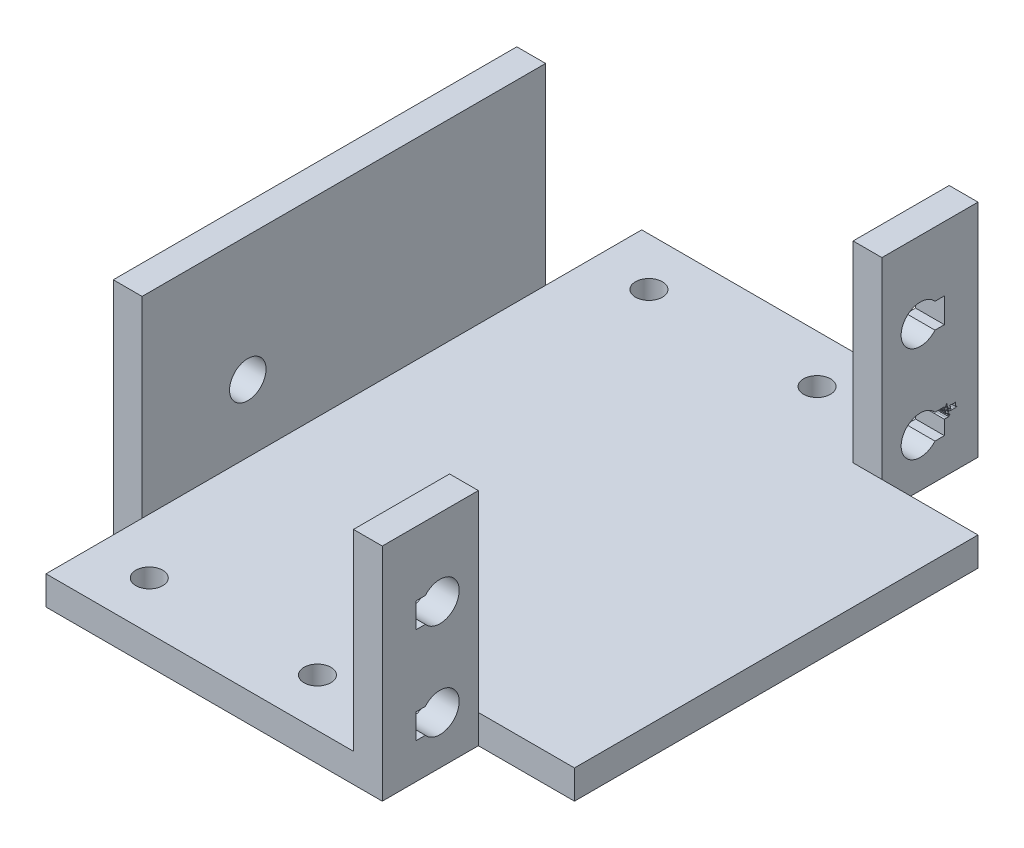
from build123d import *

# Parameters (mm, degrees)
SKETCH_2_R          = 1.4
EXTRUDE_1_DEPTH     = 3
SKETCH_3_W          = 3
SKETCH_3_H          = 10
SKETCH_3_H_2        = 42
EXTRUDE_2_DEPTH     = 23
SKETCH_4_R          = 1.9
CUT_EXTRUDE_1_DEPTH = 3
CUT_EXTRUDE_2_DEPTH = 3


with BuildPart() as part:
    # 草图2 → 凸台-拉伸1 (new body)
    with BuildSketch(Plane(origin=(0, 0, 0), x_dir=(1, 0, 0), z_dir=(0, 1, 0))):
        Polygon((14, 21), (11, 21), (11, 31), (-21, 31), (-21, 21), (-21, -21), (-21, -31), (11, -31), (11, -21), (14, -21), (24, -21), (24, 21), align=None)
        with Locations(Location((-15.25, -26, 0), (0, 0, 270))):
            Circle(SKETCH_2_R, mode=Mode.SUBTRACT)
        with Locations(Location((2.25, -26, 0), (0, 0, 270))):
            Circle(SKETCH_2_R, mode=Mode.SUBTRACT)
        with Locations(Location((-15.25, 26, 0), (0, 0, 270))):
            Circle(SKETCH_2_R, mode=Mode.SUBTRACT)
        with Locations(Location((2.25, 26, 0), (0, 0, 270))):
            Circle(SKETCH_2_R, mode=Mode.SUBTRACT)
    extrude(amount=EXTRUDE_1_DEPTH)

    # 草图3 → 凸台-拉伸2 (add)
    with BuildSketch(Plane(origin=(0, 0, 0), x_dir=(1, 0, 0), z_dir=(0, 1, 0))):
        with Locations((12.5, 26)):
            Rectangle(SKETCH_3_W, SKETCH_3_H)
        with Locations((12.5, -26)):
            Rectangle(SKETCH_3_W, SKETCH_3_H)
        with Locations((-22.5, 0)):
            Rectangle(SKETCH_3_W, SKETCH_3_H_2)
    extrude(amount=EXTRUDE_2_DEPTH)

    # 草图4 → 切除-拉伸1 (cut)
    with BuildSketch(Plane.ZY.offset(24)):
        with Locations((10.000200581, 10.000033117)):
            Circle(SKETCH_4_R)
    extrude(amount=-CUT_EXTRUDE_1_DEPTH, mode=Mode.SUBTRACT)

    # 草图5 → 切除-拉伸2 (cut)
    with BuildSketch(Plane(origin=(14, 0, 0), x_dir=(0, 0, -1), z_dir=(1, 0, 0))):
        with BuildLine():
            Line((27.500074714, 16.300093821), (26.519943129, 16.300093821))
            ThreePointArc((26.519943129, 16.300093821), (23.000074714, 15.000093821), (26.519943129, 13.700093821))
            Line((26.519943129, 13.700093821), (27.500074714, 13.700093821))
            Line((27.500074714, 13.700093821), (27.500074714, 16.300093821))
        make_face()
        with BuildLine():
            Line((-26.519793701, 6.300093821), (-27.499925286, 6.300093821))
            Line((-27.499925286, 6.300093821), (-27.499925286, 3.700093821))
            Line((-27.499925286, 3.700093821), (-26.519793701, 3.700093821))
            ThreePointArc((-26.519793701, 3.700093821), (-22.999925286, 5.000093821), (-26.519793701, 6.300093821))
        make_face()
        with BuildLine():
            Line((-27.499925286, 16.300093821), (-27.499925286, 13.700093821))
            Line((-27.499925286, 13.700093821), (-26.519793701, 13.700093821))
            ThreePointArc((-26.519793701, 13.700093821), (-22.999925286, 15.000093821), (-26.519793701, 16.300093821))
            Line((-26.519793701, 16.300093821), (-27.499925286, 16.300093821))
        make_face()
        with BuildLine():
            Line((27.500074714, 6.115914392), (27.552958342, 6.141366405))
            Line((27.552958342, 6.141366405), (27.662909333, 6.190908276))
            Line((27.662909333, 6.190908276), (27.783727573, 6.247162272))
            Line((27.783727573, 6.247162272), (27.746970701, 6.469301628))
            Line((27.746970701, 6.469301628), (27.706058705, 6.469301628))
            add(Edge.make_bspline(
                [(27.706058705, 6.469301628), (27.704396649, 6.45787626), (27.701193778, 6.435858947), (27.694139947, 6.404343156), (27.68548571, 6.375802175), (27.676081998, 6.349713803), (27.664554434, 6.326925453), (27.652002919, 6.306673286), (27.638013907, 6.289163989), (27.615780806, 6.269408305), (27.582913248, 6.245946024), (27.542398973, 6.218404009), (27.513558276, 6.200703221), (27.500074714, 6.192616242)],
                knots=[0.618132606, 0.618132606, 0.618132606, 0.618132606, 0.654491725, 0.688198628, 0.719732119, 0.748405423, 0.775420351, 0.800001443, 0.823377793, 0.845704363, 0.893426251, 0.950483432, 1, 1, 1, 1], degree=3))
            Line((27.500074714, 6.192616242), (27.500074714, 6.300093821))
            Line((27.500074714, 6.300093821), (26.519943129, 6.300093821))
            ThreePointArc((26.519943129, 6.300093821), (23.000074714, 5.000093821), (26.519943129, 3.700093821))
            Line((26.519943129, 3.700093821), (27.500074714, 3.700093821))
            Line((27.500074714, 3.700093821), (27.500074714, 5.181510314))
            Line((27.500074714, 5.181510314), (27.721081078, 5.187605485))
            Line((27.721081078, 5.187605485), (27.753363201, 5.18984286))
            add(Edge.make_bspline(
                [(27.753363201, 5.18984286), (27.759016371, 5.18971796), (27.772708972, 5.18941544), (27.794575853, 5.186428955), (27.816978948, 5.184377517), (27.837005092, 5.182192987), (27.8555767, 5.18031232), (27.873576813, 5.174878748), (27.889338348, 5.170691781), (27.900477042, 5.167910831), (27.90813758, 5.169187885), (27.915838929, 5.171145749), (27.926351211, 5.17493901), (27.934474077, 5.177517939), (27.93906531, 5.178975611)],
                knots=[0, 0, 0, 0, 0.089602961, 0.217028202, 0.349494203, 0.446323144, 0.536639958, 0.644815585, 0.742758213, 0.797475586, 0.823041142, 0.864835072, 0.92360162, 1, 1, 1, 1], degree=3))
            Line((27.93906531, 5.178975611), (27.984452056, 5.194317609))
            Line((27.984452056, 5.194317609), (28.029519178, 5.209339983))
            add(Edge.make_bspline(
                [(28.029519178, 5.209339983), (28.034969154, 5.211217153), (28.04485416, 5.214621909), (28.057949488, 5.219746641), (28.068066927, 5.224032739), (28.074876518, 5.228153118), (28.079097506, 5.231646205), (28.079942949, 5.236121148), (28.075615588, 5.238790895), (28.063020887, 5.242657385), (28.040485407, 5.24724816), (28.02033809, 5.249255838), (28.010341679, 5.25025198)],
                knots=[0, 0, 0, 0, 0.133480499, 0.242102974, 0.326053141, 0.38700961, 0.42718664, 0.449535831, 0.479255152, 0.529229463, 0.766419721, 1, 1, 1, 1], degree=3))
            Line((28.010341679, 5.25025198), (27.882811315, 5.25025198))
            Line((27.882811315, 5.25025198), (27.839661943, 5.470473586))
            Line((27.839661943, 5.470473586), (27.889523439, 5.440109214))
            Line((27.889523439, 5.440109214), (27.982214682, 5.373307594))
            Line((27.982214682, 5.373307594), (28.020889303, 5.345180597))
            Line((28.020889303, 5.345180597), (28.044861176, 5.330158223))
            Line((28.044861176, 5.330158223), (28.077143299, 5.345180597))
            Line((28.077143299, 5.345180597), (28.046778926, 5.375544969))
            add(Edge.make_bspline(
                [(28.046778926, 5.375544969), (28.037373427, 5.384366411), (28.016713165, 5.403743724), (27.981265329, 5.43329064), (27.938285462, 5.465465996), (27.898036906, 5.494614249), (27.861368513, 5.519396699), (27.829807615, 5.539309753), (27.79513429, 5.559920654), (27.757201855, 5.581454173), (27.71600634, 5.603711358), (27.671714116, 5.627002085), (27.624189578, 5.651080226), (27.591335699, 5.667088243), (27.574373216, 5.675353194)],
                knots=[0, 0, 0, 0, 0.068854504, 0.151246853, 0.246266174, 0.35553169, 0.41660237, 0.482583009, 0.554790377, 0.63199618, 0.715502741, 0.804832493, 0.89923486, 1, 1, 1, 1], degree=3))
            Line((27.574373216, 5.675353194), (27.602500213, 5.705397942))
            Line((27.602500213, 5.705397942), (27.619759962, 5.72265769))
            Line((27.619759962, 5.72265769), (27.604737588, 5.768044437))
            Line((27.604737588, 5.768044437), (27.589395589, 5.817586307))
            Line((27.589395589, 5.817586307), (27.578847965, 5.862973054))
            Line((27.578847965, 5.862973054), (27.82463957, 5.856580554))
            Line((27.82463957, 5.856580554), (27.844136693, 5.742154814))
            Line((27.844136693, 5.742154814), (27.856921692, 5.644988822))
            Line((27.856921692, 5.644988822), (27.865551566, 5.569557328))
            add(Edge.make_bspline(
                [(27.865551566, 5.569557328), (27.86603203, 5.565545425), (27.866801172, 5.559123031), (27.875678787, 5.554122084), (27.883757809, 5.558224891), (27.888754512, 5.561437462), (27.891441189, 5.563164829)],
                knots=[0, 0, 0, 0, 0.313511401, 0.501879933, 0.732165914, 1, 1, 1, 1], degree=3))
            Line((27.891441189, 5.563164829), (27.924042936, 5.591291826))
            add(Edge.make_bspline(
                [(27.924042936, 5.591291826), (27.928403384, 5.59482366), (27.935946814, 5.600933617), (27.945511936, 5.608430148), (27.95140438, 5.61341078), (27.95346863, 5.616311534), (27.954087684, 5.617181449)],
                knots=[0, 0, 0, 0, 0.423094874, 0.731940217, 0.919610768, 1, 1, 1, 1], degree=3))
            Line((27.954087684, 5.617181449), (27.941302685, 5.660330821))
            Line((27.941302685, 5.660330821), (27.930435436, 5.703480192))
            Line((27.930435436, 5.703480192), (27.915413062, 5.759414562))
            Line((27.915413062, 5.759414562), (27.893678564, 5.856580554))
            Line((27.893678564, 5.856580554), (28.169834541, 5.84795068))
            Line((28.169834541, 5.84795068), (28.200198913, 5.701242817))
            Line((28.200198913, 5.701242817), (28.042623801, 5.66224857))
            Line((28.042623801, 5.66224857), (28.051253676, 5.636358948))
            Line((28.051253676, 5.636358948), (28.200198913, 5.644988822))
            Line((28.200198913, 5.644988822), (28.532289261, 5.653618696))
            Line((28.532289261, 5.653618696), (28.581831132, 5.653618696))
            add(Edge.make_bspline(
                [(28.581831132, 5.653618696), (28.593057283, 5.652842688), (28.614824711, 5.651338015), (28.640878118, 5.645511497), (28.659564258, 5.640671643), (28.671065412, 5.638020793), (28.68015509, 5.636523041), (28.687580982, 5.635130679), (28.695225159, 5.635552717), (28.704238867, 5.638190593), (28.715678344, 5.641942483), (28.72397959, 5.645352995), (28.728538994, 5.647226197)],
                knots=[0, 0, 0, 0, 0.224188395, 0.434699729, 0.531100446, 0.609485376, 0.669941093, 0.715029965, 0.75971625, 0.821062161, 0.901719588, 1, 1, 1, 1], degree=3))
            Line((28.728538994, 5.647226197), (28.78031824, 5.664485945))
            Line((28.78031824, 5.664485945), (28.821549862, 5.679508319))
            Line((28.821549862, 5.679508319), (28.847439484, 5.688138193))
            add(Edge.make_bspline(
                [(28.847439484, 5.688138193), (28.850459241, 5.689997157), (28.855468639, 5.693080945), (28.861417208, 5.697591161), (28.863600552, 5.703115593), (28.860070016, 5.707835552), (28.853117449, 5.709917519), (28.843115032, 5.712320139), (28.829216616, 5.713161458), (28.818773602, 5.713716627), (28.812919987, 5.714027816)],
                knots=[0, 0, 0, 0, 0.141767966, 0.235175254, 0.297187314, 0.352717955, 0.446125244, 0.581478564, 0.765406478, 1, 1, 1, 1], degree=3))
            Line((28.812919987, 5.714027816), (28.692101747, 5.718502566))
            Line((28.692101747, 5.718502566), (28.65758225, 5.96237642))
            Line((28.65758225, 5.96237642), (28.646715001, 6.061460162))
            Line((28.646715001, 6.061460162), (28.638085127, 6.147758905))
            add(Edge.make_bspline(
                [(28.638085127, 6.147758905), (28.637991242, 6.151479677), (28.637830507, 6.157849759), (28.630138738, 6.162589748), (28.623142267, 6.161145823), (28.615570577, 6.15799559), (28.605955085, 6.152499674), (28.598855085, 6.1480035), (28.594935755, 6.14552153)],
                knots=[0, 0, 0, 0, 0.185257217, 0.317166307, 0.413973825, 0.553655744, 0.753609829, 1, 1, 1, 1], degree=3))
            Line((28.594935755, 6.14552153), (28.540919135, 6.109084283))
            Line((28.540919135, 6.109084283), (28.312387279, 6.130499156))
            add(Edge.make_bspline(
                [(28.312387279, 6.130499156), (28.303637687, 6.131129062), (28.287384738, 6.132299155), (28.264991285, 6.13559178), (28.246202394, 6.137645505), (28.227044662, 6.141884355), (28.207150049, 6.148364686), (28.188755054, 6.160582801), (28.175552972, 6.172729325), (28.164563717, 6.180866509), (28.155688455, 6.185906589), (28.148381758, 6.18817288), (28.142071181, 6.187113711), (28.135935481, 6.184628943), (28.128672452, 6.179703691), (28.123261583, 6.17579384), (28.12029267, 6.173648528)],
                knots=[0, 0, 0, 0, 0.125290622, 0.232735644, 0.323379035, 0.395044992, 0.513018511, 0.619857839, 0.707379138, 0.769499668, 0.814455523, 0.853596239, 0.875126189, 0.904528566, 0.94761537, 1, 1, 1, 1], degree=3))
            Line((28.12029267, 6.173648528), (28.0554088, 6.121869282))
            add(Edge.make_bspline(
                [(28.0554088, 6.121869282), (28.052851612, 6.119351856), (28.048508207, 6.115075986), (28.046232246, 6.10574013), (28.052483069, 6.097945156), (28.058534645, 6.095306188), (28.062120925, 6.093742284)],
                knots=[0, 0, 0, 0, 0.281513941, 0.478153807, 0.690743907, 1, 1, 1, 1], degree=3))
            Line((28.062120925, 6.093742284), (28.128922544, 6.063697537))
            Line((28.128922544, 6.063697537), (28.158967292, 5.910597175))
            Line((28.158967292, 5.910597175), (27.887286064, 5.916989674))
            Line((27.887286064, 5.916989674), (27.863633816, 6.033333164))
            Line((27.863633816, 6.033333164), (27.850529193, 6.130499156))
            Line((27.850529193, 6.130499156), (27.839661943, 6.227665148))
            add(Edge.make_bspline(
                [(27.839661943, 6.227665148), (27.839533328, 6.231931378), (27.839301726, 6.239613728), (27.82860709, 6.24474969), (27.818143978, 6.243032418), (27.812555884, 6.238617013), (27.809617196, 6.236295023)],
                knots=[0, 0, 0, 0, 0.27867354, 0.501817184, 0.738013741, 1, 1, 1, 1], degree=3))
            Line((27.809617196, 6.236295023), (27.738340827, 6.167256028))
            add(Edge.make_bspline(
                [(27.738340827, 6.167256028), (27.746079571, 6.153696005), (27.762090123, 6.125641909), (27.779222248, 6.078428034), (27.794052453, 6.026694491), (27.800087197, 5.99005525), (27.803224696, 5.971006295)],
                knots=[0, 0, 0, 0, 0.224767438, 0.465017446, 0.721859446, 1, 1, 1, 1], degree=3))
            Line((27.803224696, 5.971006295), (27.811854571, 5.919227049))
            Line((27.811854571, 5.919227049), (27.563505966, 5.923382174))
            Line((27.563505966, 5.923382174), (27.548483593, 5.996895917))
            Line((27.548483593, 5.996895917), (27.533461219, 6.095979659))
            add(Edge.make_bspline(
                [(27.533461219, 6.095979659), (27.532945618, 6.098502078), (27.531863343, 6.103796771), (27.522530868, 6.10637218), (27.51164977, 6.104366617), (27.5050399, 6.099072144), (27.501179097, 6.095979659)],
                knots=[0, 0, 0, 0, 0.179713067, 0.377227522, 0.636240611, 1, 1, 1, 1], degree=3))
            Line((27.501179097, 6.095979659), (27.500074714, 6.094959765))
            Line((27.500074714, 6.094959765), (27.500074714, 6.115914392))
        make_face()
    extrude(amount=-CUT_EXTRUDE_2_DEPTH, mode=Mode.SUBTRACT)


solid = part.part
